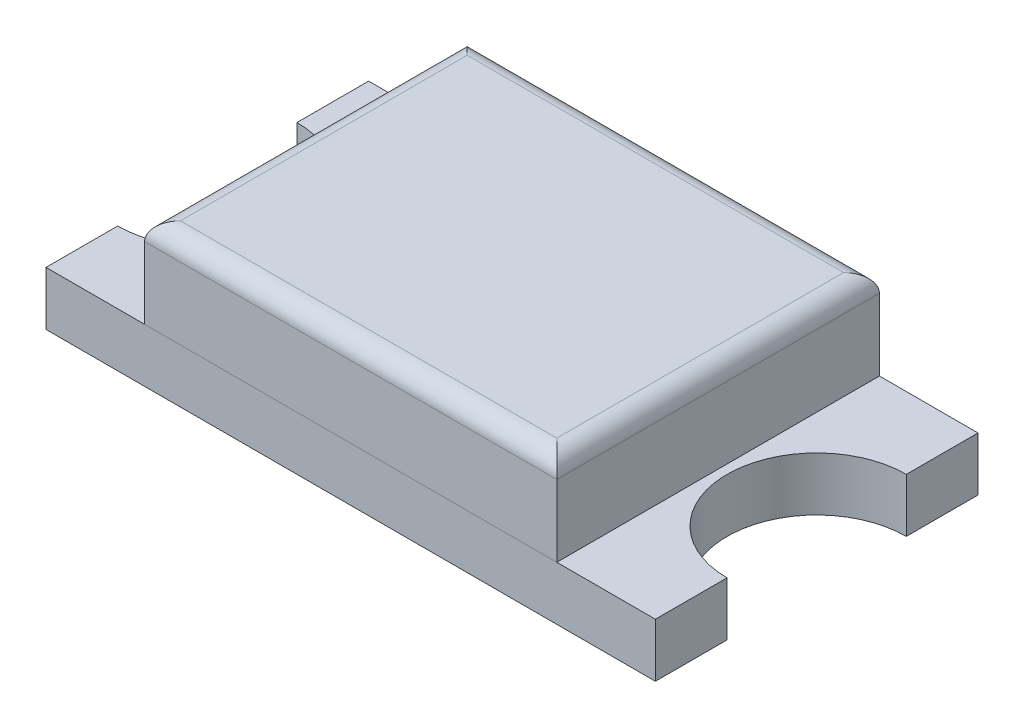
from build123d import *

# Parameters (mm, degrees)
BOSS_EXTRUDE1_DEPTH = 0.15
SKETCH2_W           = 1.15
SKETCH2_H           = 0.9
BOSS_EXTRUDE2_DEPTH = 0.25
FILLET1_R           = 0.05


with BuildPart() as part:
    # Sketch1 → Boss-Extrude1 (new body)
    with BuildSketch(Plane(origin=(0, 0, 0), x_dir=(1, 0, 0), z_dir=(0, 1, 0))):
        with BuildLine():
            Line((-0.85, -0.45), (0.85, -0.45))
            Line((0.85, -0.45), (0.85, -0.25))
            ThreePointArc((0.85, -0.25), (0.6, 0), (0.85, 0.25))
            Line((0.85, 0.25), (0.85, 0.45))
            Line((0.85, 0.45), (-0.85, 0.45))
            Line((-0.85, 0.45), (-0.85, 0.25))
            ThreePointArc((-0.85, 0.25), (-0.6, 0), (-0.85, -0.25))
            Line((-0.85, -0.25), (-0.85, -0.45))
        make_face()
    extrude(amount=BOSS_EXTRUDE1_DEPTH)


with BuildPart() as body_2:
    # Sketch2 → Boss-Extrude2 (new body)
    with BuildSketch(Plane(origin=(0, 0.15, 0), x_dir=(1, 0, 0), z_dir=(0, 1, 0))):
        Rectangle(SKETCH2_W, SKETCH2_H)
    extrude(amount=BOSS_EXTRUDE2_DEPTH)

    # Fillet1
    fillet1_edges = [body_2.edges().sort_by_distance(p)[0] for p in [
        (0.575, 0.4, 0),
        (0, 0.4, -0.45),
        (-0.575, 0.4, 0),
        (0, 0.4, 0.45),
    ]]
    fillet(fillet1_edges, radius=FILLET1_R)


solid = Compound([part.part, body_2.part])
